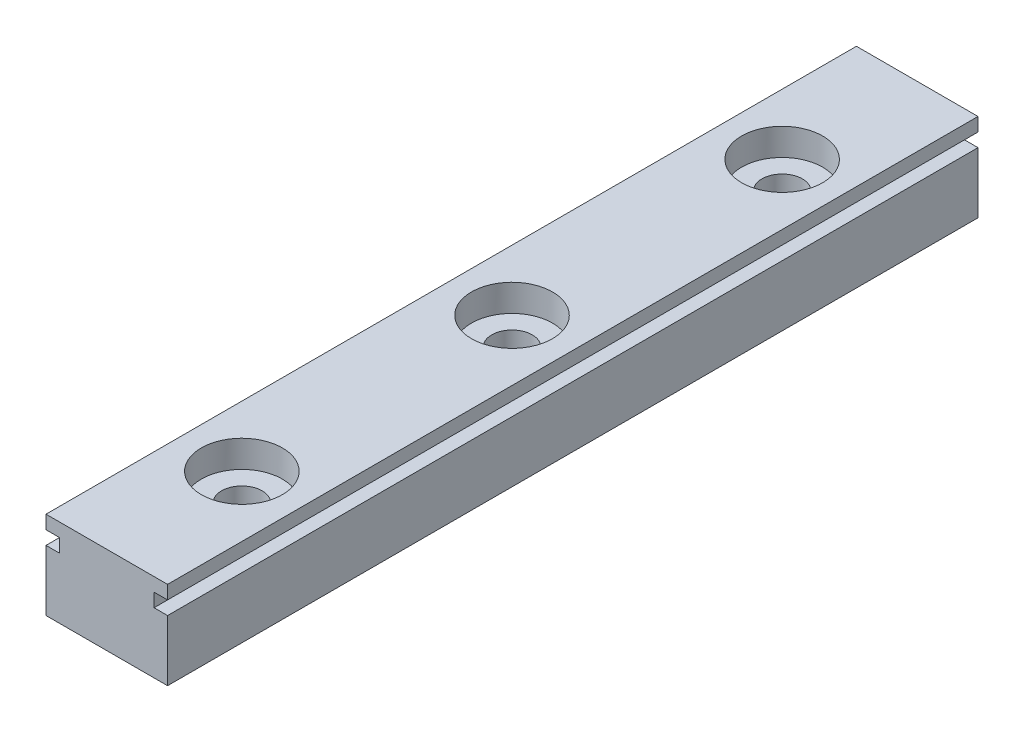
from build123d import *

# Parameters (mm, degrees)
EXTRUDE1_DEPTH = 60
SKETCH2_R      = 3
EXTRUDE2_DEPTH = 2
SKETCH3_R      = 1.5
EXTRUDE4_DEPTH = 61.336556083


with BuildPart() as part:
    # Sketch1 → Extrude1 (new body)
    with BuildSketch(Plane.XY):
        Polygon((4.5, 6.5), (-4.5, 6.5), (-4.5, 5.5), (-3.5, 5.5), (-3.5, 4.5), (-4.5, 4.5), (-4.5, 0), (4.5, 0), (4.5, 4.5), (3.5, 4.5), (3.5, 5.5), (4.5, 5.5), align=None)
    extrude(amount=EXTRUDE1_DEPTH)

    # Sketch2 → Extrude2 (cut)
    with BuildSketch(Plane(origin=(0, 6.5, 0), x_dir=(1, 0, 0), z_dir=(0, 1, 0))):
        with Locations(Location((0, -10, 0), (0, 0, 270))):
            Circle(SKETCH2_R)
        with Locations(Location((0, -30, 0), (0, 0, 270))):
            Circle(SKETCH2_R)
        with Locations(Location((0, -50, 0), (0, 0, 270))):
            Circle(SKETCH2_R)
        with Locations((0, -70)):
            Circle(SKETCH2_R)
        with Locations((0, -90)):
            Circle(SKETCH2_R)
        with Locations((0, -110)):
            Circle(SKETCH2_R)
        with Locations((0, -130)):
            Circle(SKETCH2_R)
        with Locations((0, -150)):
            Circle(SKETCH2_R)
        with Locations((0, -170)):
            Circle(SKETCH2_R)
        with Locations((0, -190)):
            Circle(SKETCH2_R)
        with Locations((0, -210)):
            Circle(SKETCH2_R)
        with Locations((0, -230)):
            Circle(SKETCH2_R)
        with Locations((0, -250)):
            Circle(SKETCH2_R)
        with Locations((0, -270)):
            Circle(SKETCH2_R)
        with Locations((0, -290)):
            Circle(SKETCH2_R)
        with Locations((0, -310)):
            Circle(SKETCH2_R)
        with Locations((0, -330)):
            Circle(SKETCH2_R)
        with Locations((0, -350)):
            Circle(SKETCH2_R)
        with Locations((0, -370)):
            Circle(SKETCH2_R)
        with Locations((0, -390)):
            Circle(SKETCH2_R)
        with Locations((0, -410)):
            Circle(SKETCH2_R)
        with Locations((0, -430)):
            Circle(SKETCH2_R)
        with Locations((0, -450)):
            Circle(SKETCH2_R)
        with Locations((0, -470)):
            Circle(SKETCH2_R)
        with Locations((0, -490)):
            Circle(SKETCH2_R)
        with Locations((0, -510)):
            Circle(SKETCH2_R)
        with Locations((0, -530)):
            Circle(SKETCH2_R)
        with Locations((0, -550)):
            Circle(SKETCH2_R)
        with Locations((0, -570)):
            Circle(SKETCH2_R)
        with Locations((0, -590)):
            Circle(SKETCH2_R)
        with Locations((0, -610)):
            Circle(SKETCH2_R)
        with Locations((0, -630)):
            Circle(SKETCH2_R)
    extrude(amount=-EXTRUDE2_DEPTH, mode=Mode.SUBTRACT)

    # Sketch3 → Extrude4 (cut, through all)
    with BuildSketch(Plane(origin=(0, 4.5, 0), x_dir=(1, 0, 0), z_dir=(0, 1, 0))):
        with Locations(Location((0, -10, 0), (0, 0, 270))):
            Circle(SKETCH3_R)
        with Locations(Location((0, -30, 0), (0, 0, 270))):
            Circle(SKETCH3_R)
        with Locations(Location((0, -50, 0), (0, 0, 270))):
            Circle(SKETCH3_R)
        with Locations((0, -70)):
            Circle(SKETCH3_R)
        with Locations((0, -90)):
            Circle(SKETCH3_R)
        with Locations((0, -110)):
            Circle(SKETCH3_R)
        with Locations((0, -130)):
            Circle(SKETCH3_R)
        with Locations((0, -150)):
            Circle(SKETCH3_R)
        with Locations((0, -170)):
            Circle(SKETCH3_R)
        with Locations((0, -190)):
            Circle(SKETCH3_R)
        with Locations((0, -210)):
            Circle(SKETCH3_R)
        with Locations((0, -230)):
            Circle(SKETCH3_R)
        with Locations((0, -250)):
            Circle(SKETCH3_R)
        with Locations((0, -270)):
            Circle(SKETCH3_R)
        with Locations((0, -290)):
            Circle(SKETCH3_R)
        with Locations((0, -310)):
            Circle(SKETCH3_R)
        with Locations((0, -330)):
            Circle(SKETCH3_R)
        with Locations((0, -350)):
            Circle(SKETCH3_R)
        with Locations((0, -370)):
            Circle(SKETCH3_R)
        with Locations((0, -390)):
            Circle(SKETCH3_R)
        with Locations((0, -410)):
            Circle(SKETCH3_R)
        with Locations((0, -430)):
            Circle(SKETCH3_R)
        with Locations((0, -450)):
            Circle(SKETCH3_R)
        with Locations((0, -470)):
            Circle(SKETCH3_R)
        with Locations((0, -490)):
            Circle(SKETCH3_R)
        with Locations((0, -510)):
            Circle(SKETCH3_R)
        with Locations((0, -530)):
            Circle(SKETCH3_R)
        with Locations((0, -550)):
            Circle(SKETCH3_R)
        with Locations((0, -570)):
            Circle(SKETCH3_R)
        with Locations((0, -590)):
            Circle(SKETCH3_R)
        with Locations((0, -610)):
            Circle(SKETCH3_R)
        with Locations((0, -630)):
            Circle(SKETCH3_R)
    extrude(amount=-EXTRUDE4_DEPTH, mode=Mode.SUBTRACT)


solid = part.part
